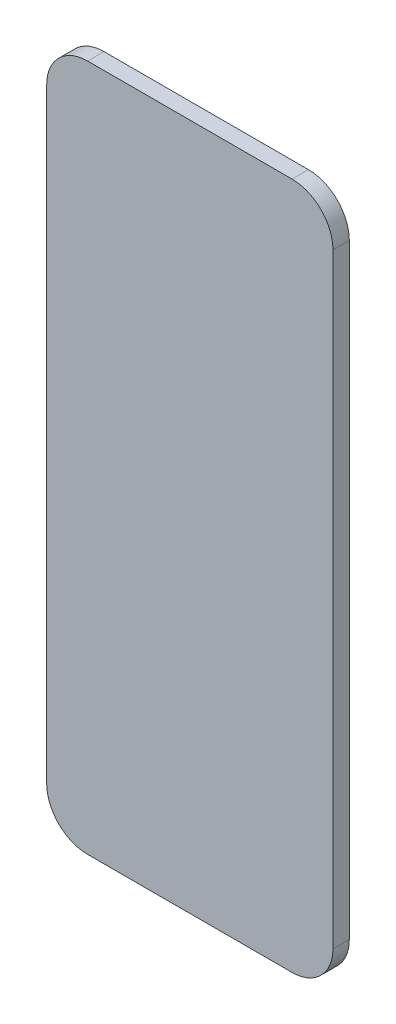
from build123d import *

# Parameters (mm, degrees)
SKETCH1_W           = 700
SKETCH1_H           = 1680
BOSS_EXTRUDE1_DEPTH = 40
FILLET1_R           = 100


with BuildPart() as part:
    # Sketch1 → Boss-Extrude1 (new body)
    with BuildSketch(Plane.XY):
        with Locations((350, 840)):
            Rectangle(SKETCH1_W, SKETCH1_H)
    extrude(amount=BOSS_EXTRUDE1_DEPTH)

    # Fillet1
    fillet1_edges = [part.edges().sort_by_distance(p)[0] for p in [
        (0, 1680, 20),
        (700, 1680, 20),
        (700, 0, 20),
        (0, 0, 20),
    ]]
    fillet(fillet1_edges, radius=FILLET1_R)


solid = part.part
